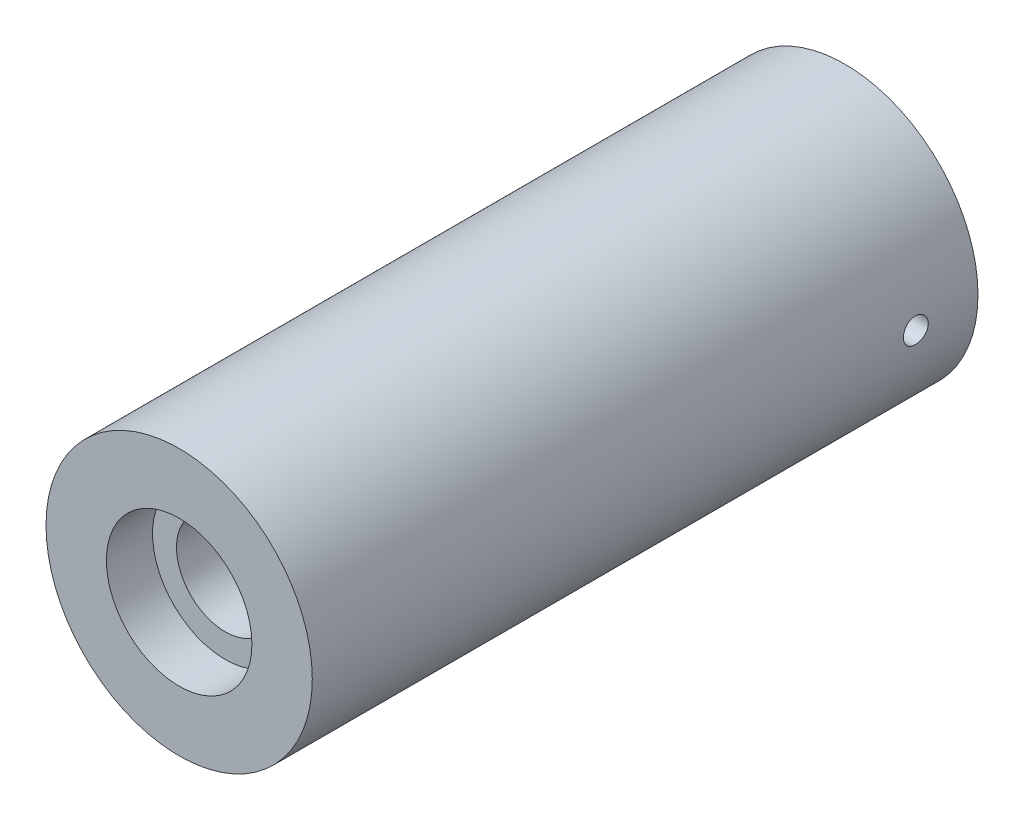
from build123d import *

# Parameters (mm, degrees)
SKETCH1_R           = 15
BOSS_EXTRUDE1_DEPTH = 75
SKETCH2_R           = 8.2
CUT_EXTRUDE1_DEPTH  = 5.2
CUT_EXTRUDE2_DEPTH  = 25
SKETCH5_R           = 1.4
CUT_EXTRUDE4_DEPTH  = 14
SKETCH6_R           = 5.5
CUT_EXTRUDE5_DEPTH  = 25
CUT_EXTRUDE6_DEPTH  = 10


with BuildPart() as part:
    # Sketch1 → Boss-Extrude1 (new body)
    with BuildSketch(Plane.XY):
        Circle(SKETCH1_R)
    extrude(amount=BOSS_EXTRUDE1_DEPTH)

    # Sketch2 → Cut-Extrude1 (cut)
    with BuildSketch(Plane.XY.offset(75)):
        Circle(SKETCH2_R)
    extrude(amount=-CUT_EXTRUDE1_DEPTH, mode=Mode.SUBTRACT)

    # Sketch3 → Cut-Extrude2 (cut)
    with BuildSketch(Plane(origin=(0, 0, 0), x_dir=(-1, 0, 0), z_dir=(0, 0, -1))):
        with BuildLine():
            Line((-2.25, 1.089724736), (-2.25, -1.089724736))
            ThreePointArc((-2.25, -1.089724736), (2.5, 0), (-2.25, 1.089724736))
        make_face()
    extrude(amount=-CUT_EXTRUDE2_DEPTH, mode=Mode.SUBTRACT)

    # Sketch5 → Cut-Extrude4 (cut)
    with BuildSketch(Plane(origin=(15, 0, 0), x_dir=(0, 0, -1), z_dir=(1, 0, 0))):
        with Locations((-7, 0)):
            Circle(SKETCH5_R)
    extrude(amount=-CUT_EXTRUDE4_DEPTH, mode=Mode.SUBTRACT)

    # Sketch6 → Cut-Extrude5 (cut)
    with BuildSketch(Plane.XY.offset(69.8)):
        Circle(SKETCH6_R)
    extrude(amount=-CUT_EXTRUDE5_DEPTH, mode=Mode.SUBTRACT)

    # Sketch8 → Cut-Extrude6 (cut)
    with BuildSketch(Plane(origin=(0, 0, 0), x_dir=(-1, 0, 0), z_dir=(0, 0, -1))):
        with BuildLine():
            Line((-2.25, 1.089724736), (-2.25, -1.089724736))
            ThreePointArc((-2.25, -1.089724736), (-2.5, 0), (-2.25, 1.089724736))
        make_face()
    extrude(amount=-CUT_EXTRUDE6_DEPTH, mode=Mode.SUBTRACT)


solid = part.part
